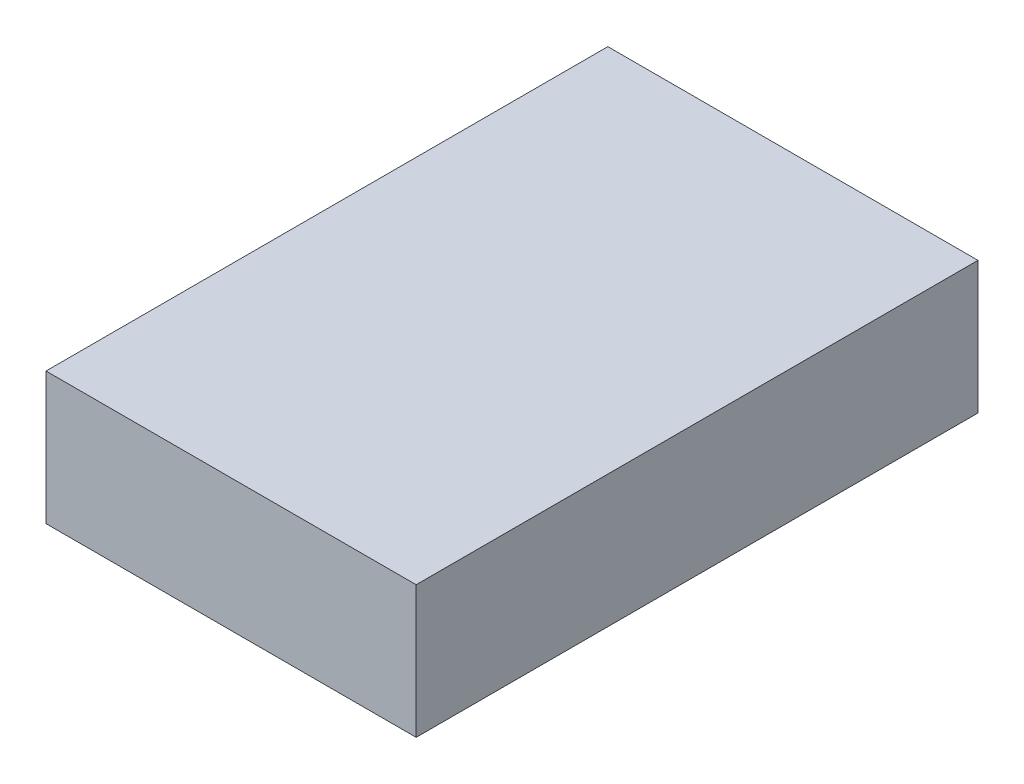
from build123d import *

# Parameters (mm, degrees)
SKETCH1_W           = 112
SKETCH1_H           = 170
BOSS_EXTRUDE1_DEPTH = 40


with BuildPart() as part:
    # Sketch1 → Boss-Extrude1 (new body)
    with BuildSketch(Plane(origin=(0, 0, 0), x_dir=(1, 0, 0), z_dir=(0, 1, 0))):
        with Locations((56, 85)):
            Rectangle(SKETCH1_W, SKETCH1_H)
    extrude(amount=BOSS_EXTRUDE1_DEPTH)


solid = part.part
